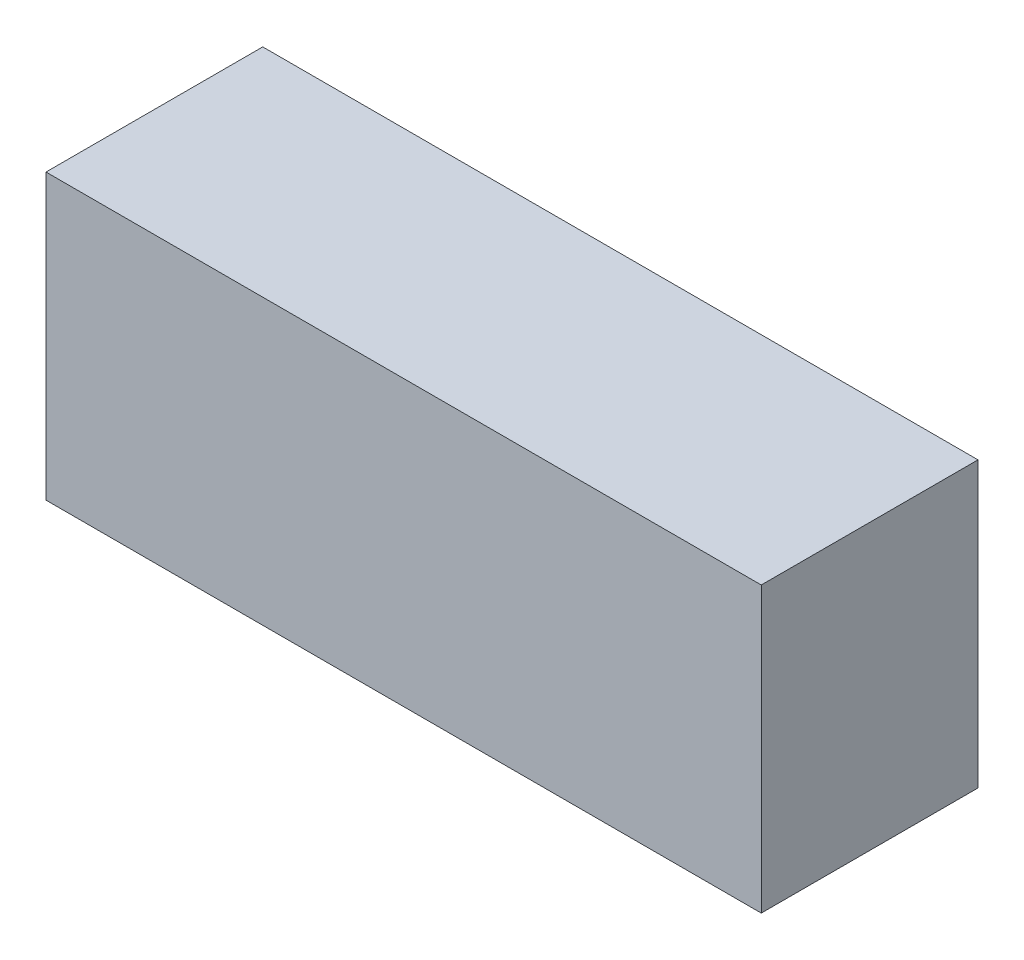
from build123d import *

# Parameters (mm, degrees)
CROQUIS1_W              = 89.1
CROQUIS1_H              = 35.4
SALIENTE_EXTRUIR1_DEPTH = 27


with BuildPart() as part:
    # Croquis1 → Saliente-Extruir1 (new body)
    with BuildSketch(Plane.XY):
        Rectangle(CROQUIS1_W, CROQUIS1_H)
    extrude(amount=SALIENTE_EXTRUIR1_DEPTH)


solid = part.part
